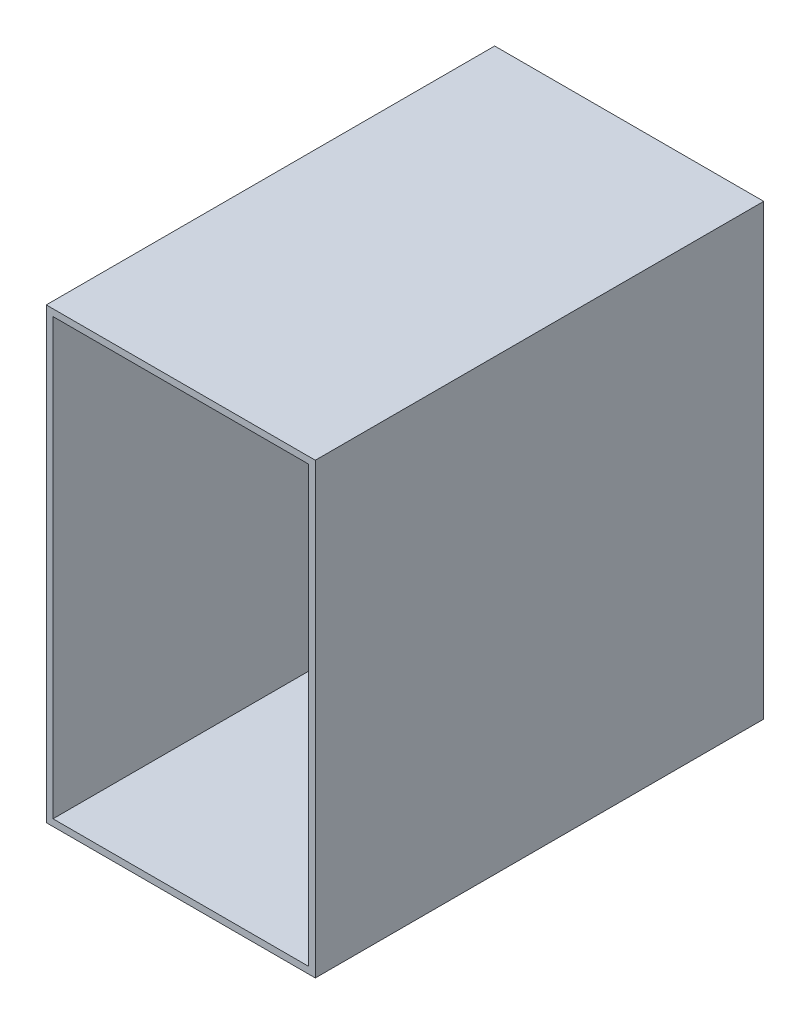
from build123d import *

# Parameters (mm, degrees)
CROQUIS2_W              = 120
CROQUIS2_H              = 200
SALIENTE_EXTRUIR1_DEPTH = 200
VACIADO1_T              = -3
CROQUIS4_R              = 10
SALIENTE_EXTRUIR2_DEPTH = 80


with BuildPart() as part:
    # Croquis2 → Saliente-Extruir1 (new body)
    with BuildSketch(Plane.XY):
        with Locations((60, 100)):
            Rectangle(CROQUIS2_W, CROQUIS2_H)
    extrude(amount=SALIENTE_EXTRUIR1_DEPTH)

    # Vaciado1
    vaciado1_openings = [part.faces().sort_by_distance(p)[0] for p in [
        (60, 100, 200),
    ]]
    offset(amount=VACIADO1_T, openings=vaciado1_openings, kind=Kind.INTERSECTION)

    # Croquis4 → Saliente-Extruir2 (add)
    with BuildSketch(Plane.ZY.offset(-117)):
        with Locations((100, 100)):
            Circle(CROQUIS4_R)
    extrude(amount=SALIENTE_EXTRUIR2_DEPTH)


solid = part.part
